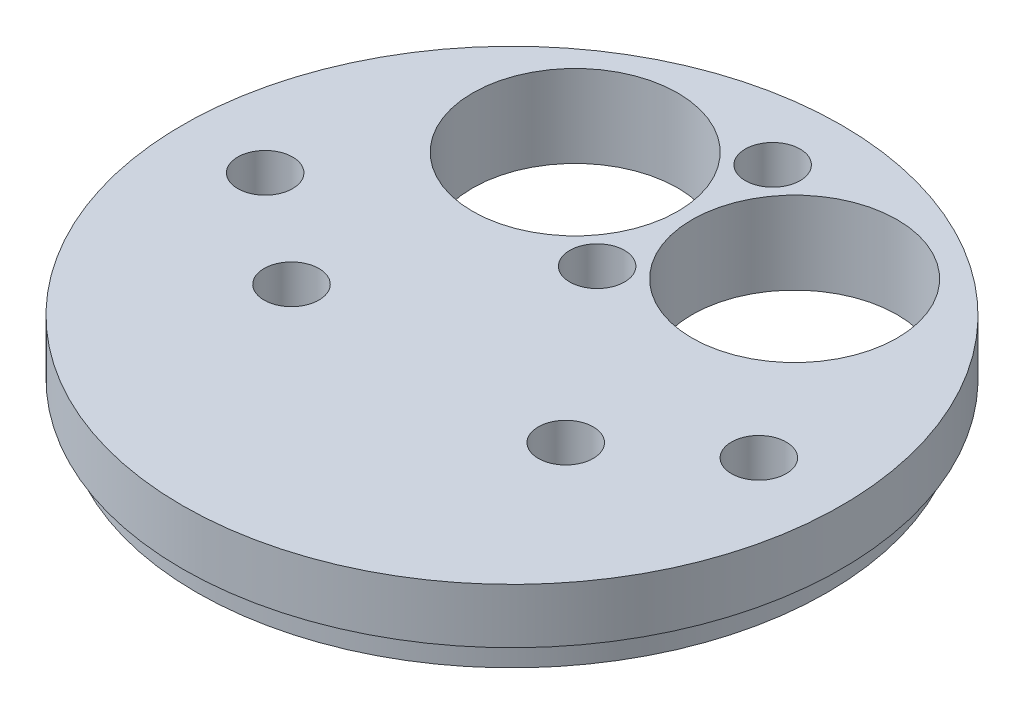
from build123d import *

# Parameters (mm, degrees)
CUT_EXTRUDE1_DEPTH      = 55.787705795
CUT_EXTRUDE1_DEPTH_BACK = 55.787705795
SKETCH2_R               = 11.8745
SKETCH2_R_2             = 3.175
CUT_EXTRUDE2_DEPTH      = 55.787705795
CUT_EXTRUDE2_DEPTH_BACK = 55.787705795
SKETCH3_R               = 3.175
CUT_EXTRUDE3_DEPTH      = 55.787705795
CUT_EXTRUDE3_DEPTH_BACK = 55.787705795
SKETCH4_R               = 3.175


with BuildPart() as part:
    # Sketch1 → Revolve1 (revolve)
    with BuildSketch(Plane.XY):
        Polygon((0, 0), (36.5125, 0), (36.5125, 3.175), (38.1508, 3.175), (38.1508, 9.525), (0, 9.525), align=None)
    revolve(axis=Axis((0, 0, 0), (0, 1, 0)))

    # Sketch2 → Cut-Extrude1 (cut, two sides: drawn at the far end of the back side and taken through both)
    with BuildSketch(Plane(origin=(0, 9.525, 0), x_dir=(1, 0, 0), z_dir=(0, 1, 0)).offset(-CUT_EXTRUDE1_DEPTH_BACK)):
        with Locations((-12.7, 20.0152)):
            Circle(SKETCH2_R)
        with Locations((12.7, 20.0152)):
            Circle(SKETCH2_R)
        with Locations((0, 30.1752)):
            Circle(SKETCH2_R_2)
        with Locations((0, 9.8552)):
            Circle(SKETCH2_R_2)
    extrude(amount=CUT_EXTRUDE1_DEPTH + CUT_EXTRUDE1_DEPTH_BACK, mode=Mode.SUBTRACT)

    # Sketch3 → Cut-Extrude2 (cut, two sides: drawn at the far end of the back side and taken through both)
    with BuildSketch(Plane(origin=(0, 9.525, 0), x_dir=(1, 0, 0), z_dir=(0, 1, 0)).offset(-CUT_EXTRUDE2_DEPTH_BACK)):
        with Locations((-28.575, 0)):
            Circle(SKETCH3_R)
        with Locations((28.575, 0)):
            Circle(SKETCH3_R)
    extrude(amount=CUT_EXTRUDE2_DEPTH + CUT_EXTRUDE2_DEPTH_BACK, mode=Mode.SUBTRACT)

    # Sketch4 → Cut-Extrude3 (cut, two sides: drawn at the far end of the back side and taken through both)
    with BuildSketch(Plane(origin=(0, 9.525, 0), x_dir=(1, 0, 0), z_dir=(0, 1, 0)).offset(-CUT_EXTRUDE3_DEPTH_BACK)):
        with Locations((-15.875, -9.652)):
            Circle(SKETCH4_R)
        with Locations((15.875, -9.652)):
            Circle(SKETCH4_R)
    extrude(amount=CUT_EXTRUDE3_DEPTH + CUT_EXTRUDE3_DEPTH_BACK, mode=Mode.SUBTRACT)


solid = part.part
